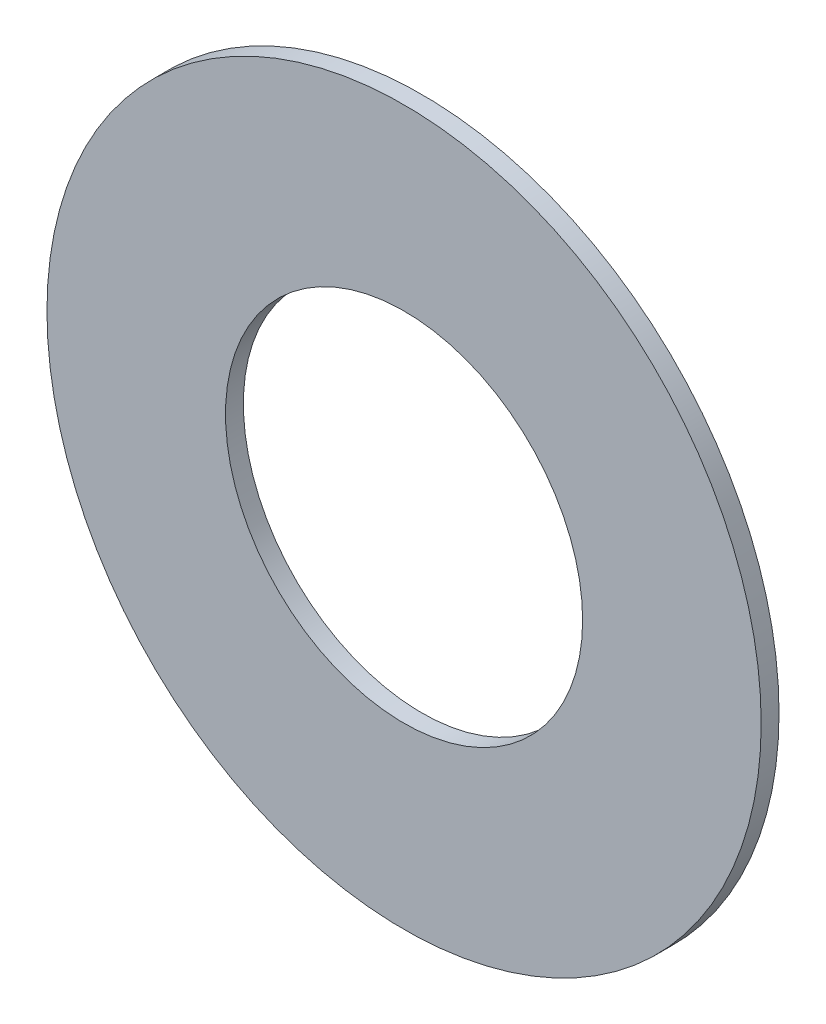
from build123d import *

# Parameters (mm, degrees)
SKETCH1_R           = 10
SKETCH1_R_2         = 5
BOSS_EXTRUDE1_DEPTH = 0.5


with BuildPart() as part:
    # Sketch1 → Boss-Extrude1 (new body)
    with BuildSketch(Plane.XY):
        Circle(SKETCH1_R)
        Circle(SKETCH1_R_2, mode=Mode.SUBTRACT)
    extrude(amount=BOSS_EXTRUDE1_DEPTH)


solid = part.part
